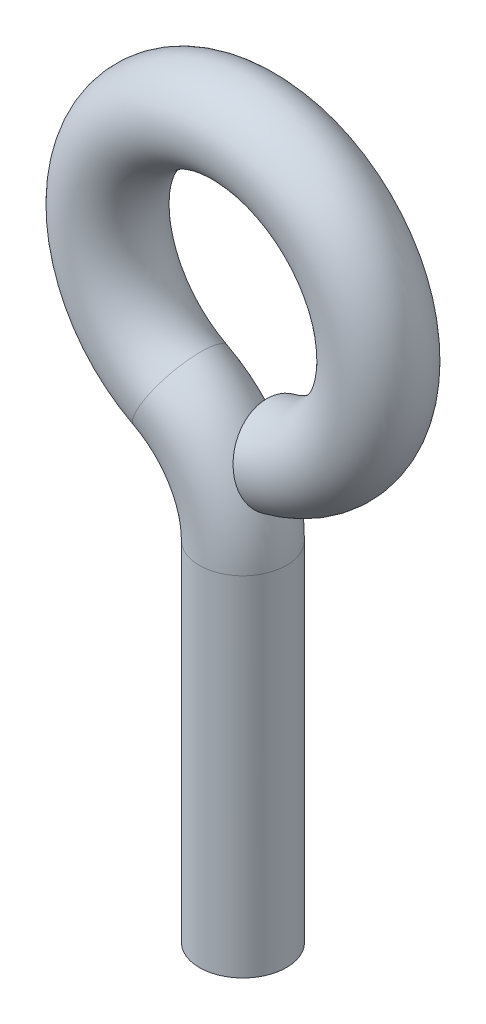
from build123d import *

# Parameters (mm, degrees)
SKETCH2_R = 2.25


with BuildPart() as part:
    # Sweep1: sweep along a path in Sketch1
    with BuildLine(Plane.XY) as sweep1_path:
        Line((0, 0), (0, 18))
        ThreePointArc((0, 18), (-0.871997764, 21.119311468), (-3.235171554, 23.334236697))
        ThreePointArc((-3.235171554, 23.334236697), (0.763710809, 36.5), (1.811733316, 22.780304948))
    # Sketch2 → Sweep1 (sweep)
    with BuildSketch(Plane(origin=(0, 0, 0), x_dir=(1, 0, 0), z_dir=(0, 1, 0))):
        Circle(SKETCH2_R)
    sweep(path=sweep1_path.line)


solid = part.part
